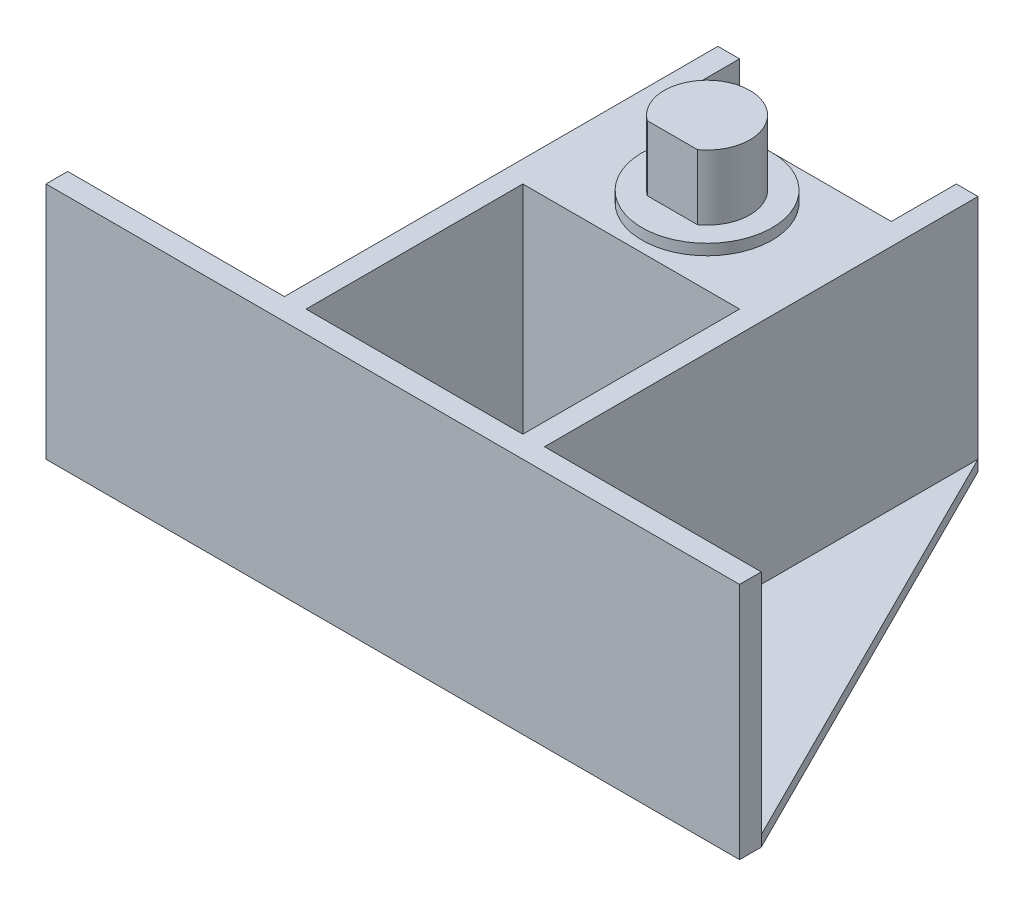
from build123d import *

# Parameters (mm, degrees)
SKETCH1_R           = 3.95
BOSS_EXTRUDE1_DEPTH = 6
SKETCH2_R           = 6
BOSS_EXTRUDE2_DEPTH = 1
SKETCH3_W           = 24
SKETCH3_H           = 14
SKETCH3_H_2         = 26
SKETCH3_R           = 6
BOSS_EXTRUDE3_DEPTH = 21
SKETCH6_W           = 64
SKETCH6_H           = 2
BOSS_EXTRUDE5_DEPTH = 21
SKETCH8_W           = 20
SKETCH8_H           = 20
SKETCH8_H_2         = 6
CUT_EXTRUDE1_DEPTH  = 49.020828814
SKETCH9_W           = 4.63141447
SKETCH9_H           = 1.5
CUT_EXTRUDE2_DEPTH  = 6
BOSS_EXTRUDE6_DEPTH = 1
SKETCH11_W          = 20
SKETCH11_H          = 20
CUT_EXTRUDE3_DEPTH  = 52.46843693


with BuildPart() as part:
    # Sketch1 → Boss-Extrude1 (new body)
    with BuildSketch(Plane(origin=(0, 0, 0), x_dir=(1, 0, 0), z_dir=(0, 1, 0))):
        with Locations(Location((0, 0, 0), (0, 0, 270))):
            Circle(SKETCH1_R)
    extrude(amount=BOSS_EXTRUDE1_DEPTH)

    # Sketch2 → Boss-Extrude2 (add)
    with BuildSketch(Plane.XZ):
        with Locations(Location((0, 0, 0), (0, 0, 270))):
            Circle(SKETCH2_R)
    extrude(amount=BOSS_EXTRUDE2_DEPTH)

    # Sketch3 → Boss-Extrude3 (add)
    # profile 1 of 3: a face of its own
    with BuildSketch(Plane.XZ.offset(1)):
        with Locations((0, 20)):
            Rectangle(SKETCH3_W, SKETCH3_H)
    # profile 2 of 3: a face of its own
    with BuildSketch(Plane.XZ.offset(1)):
        Rectangle(SKETCH3_W, SKETCH3_H_2)
        with Locations(Location((0, 0, 0), (0, 0, 270))):
            Circle(SKETCH3_R, mode=Mode.SUBTRACT)
    # profile 3 of 3: a face of its own
    with BuildSketch(Plane.XZ.offset(1)):
        with Locations(Location((0, 0, 0), (0, 0, 270))):
            Circle(SKETCH3_R)
    extrude(amount=BOSS_EXTRUDE3_DEPTH)

    # Sketch6 → Boss-Extrude5 (add)
    with BuildSketch(Plane.XZ.offset(22)):
        with Locations((0, 28)):
            Rectangle(SKETCH6_W, SKETCH6_H)
    extrude(amount=-BOSS_EXTRUDE5_DEPTH)

    # Sketch8 → Cut-Extrude1 (cut, through all)
    with BuildSketch(Plane(origin=(0, -1, 0), x_dir=(1, 0, 0), z_dir=(0, 1, 0))):
        with Locations((0, -17)):
            Rectangle(SKETCH8_W, SKETCH8_H)
        with Locations((0, 10)):
            Rectangle(SKETCH8_W, SKETCH8_H_2)
    extrude(amount=-CUT_EXTRUDE1_DEPTH, mode=Mode.SUBTRACT)

    # Sketch9 → Cut-Extrude2 (cut)
    with BuildSketch(Plane(origin=(0, 6, 0), x_dir=(1, 0, 0), z_dir=(0, 1, 0))):
        with Locations((0, -3.95)):
            Rectangle(SKETCH9_W, SKETCH9_H)
    extrude(amount=-CUT_EXTRUDE2_DEPTH, mode=Mode.SUBTRACT)

    # Sketch10 → Boss-Extrude6 (add)
    with BuildSketch(Plane.XZ.offset(22)):
        Polygon((-32, 29), (32, 29), (32, 27), (12, -13), (-12, -13), (-32, 27), align=None)
    extrude(amount=BOSS_EXTRUDE6_DEPTH)

    # Sketch11 → Cut-Extrude3 (cut, through all)
    with BuildSketch(Plane(origin=(0, -22, 0), x_dir=(1, 0, 0), z_dir=(0, 1, 0))):
        with Locations((0, -17)):
            Rectangle(SKETCH11_W, SKETCH11_H)
    extrude(amount=-CUT_EXTRUDE3_DEPTH, mode=Mode.SUBTRACT)


solid = part.part
